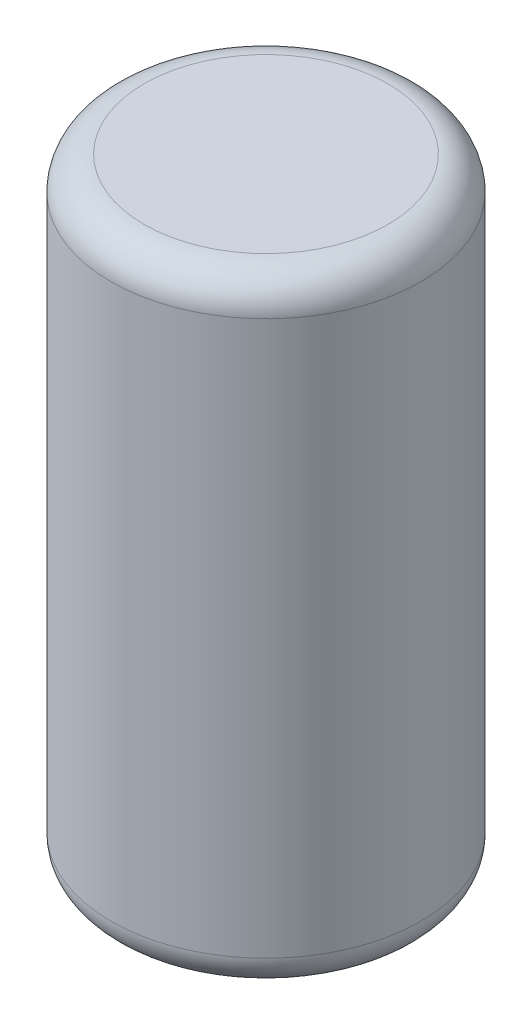
from build123d import *

# Parameters (mm, degrees)
SKETCH1_R           = 1.190625
BOSS_EXTRUDE1_DEPTH = 4.7625
FILLET2_R           = 0.254


with BuildPart() as part:
    # Sketch1 → Boss-Extrude1 (new body)
    with BuildSketch(Plane(origin=(0, 0, 0), x_dir=(1, 0, 0), z_dir=(0, 1, 0))):
        with Locations(Location((0, 0, 0), (0, 0, 90))):
            Circle(SKETCH1_R)
    extrude(amount=BOSS_EXTRUDE1_DEPTH)

    # Fillet2
    fillet2_edges = [part.edges().sort_by_distance(p)[0] for p in [
        (0, 0, 1.190625),
        (0, 4.7625, 1.190625),
    ]]
    fillet(fillet2_edges, radius=FILLET2_R)


solid = part.part
